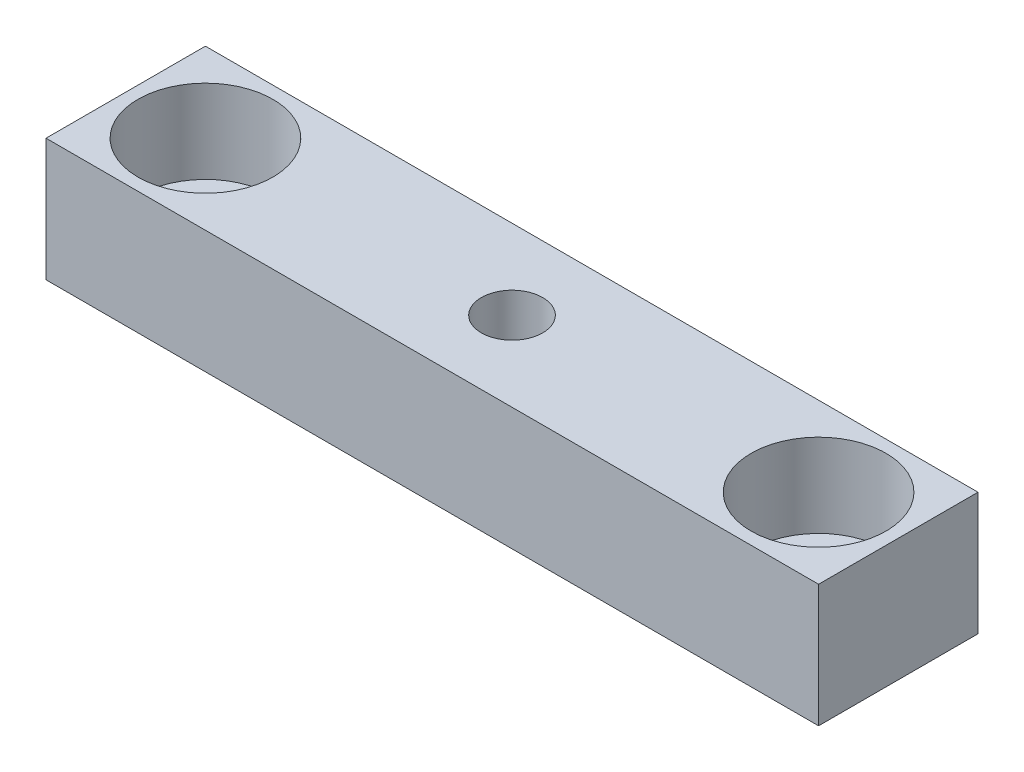
from build123d import *

# Parameters (mm, degrees)
SKETCH_1_W                = 63
SKETCH_1_H                = 13
EXTRUDE_1_DEPTH           = 10
HOLE_WIZARD_1_D           = 6.6
HOLE_WIZARD_1_CBORE_D     = 11
HOLE_WIZARD_1_CBORE_DEPTH = 6.8
MM_1_D                    = 4
MM_1_DEPTH                = 5
MM_1_TIP                  = 1.201721238
CUT_EXTRUDE_1_DEPTH       = 5
HOLE_WIZARD_M6_1_D        = 5


with BuildPart() as part:
    # 草图1 → 凸台-拉伸1 (new body)
    with BuildSketch(Plane(origin=(0, 0, 0), x_dir=(1, 0, 0), z_dir=(0, 1, 0))):
        Rectangle(SKETCH_1_W, SKETCH_1_H)
    extrude(amount=EXTRUDE_1_DEPTH)

    # 打孔尺寸(%根据)内六角圆柱头螺钉的类型1 (through all)
    with Locations(Plane(origin=(-25, 10, 0), x_dir=(0, 0, 1), z_dir=(0, 1, 0))):
        with Locations((0, 0), (0, 50)):
            CounterBoreHole(HOLE_WIZARD_1_D / 2, HOLE_WIZARD_1_CBORE_D / 2, HOLE_WIZARD_1_CBORE_DEPTH)

    # 大小mm 暗销孔1
    with Locations(Plane(origin=(-15, 0, 0), x_dir=(0, 0, -1), z_dir=(0, -1, 0))):
        with Locations((0, 0)):
            Hole(MM_1_D / 2, depth=MM_1_DEPTH)
            with Locations((0, 0, -(MM_1_DEPTH + MM_1_TIP / 2))):  # 118° drill point
                Cone(0, MM_1_D / 2, MM_1_TIP, mode=Mode.SUBTRACT)

    # 草图6 → 切除-拉伸1 (cut)
    with BuildSketch(Plane.XZ):
        with BuildLine():
            Line((14.5, 2), (15.5, 2))
            ThreePointArc((15.5, 2), (17.5, 0), (15.5, -2))
            Line((15.5, -2), (14.5, -2))
            ThreePointArc((14.5, -2), (12.5, 0), (14.5, 2))
        make_face()
    extrude(amount=-CUT_EXTRUDE_1_DEPTH, mode=Mode.SUBTRACT)

    # M6 螺纹孔1 (through all)
    with Locations(Plane(origin=(0, 0, 0), x_dir=(0, 0, -1), z_dir=(0, -1, 0))):
        with Locations((0, 0)):
            Hole(HOLE_WIZARD_M6_1_D / 2)


solid = part.part
